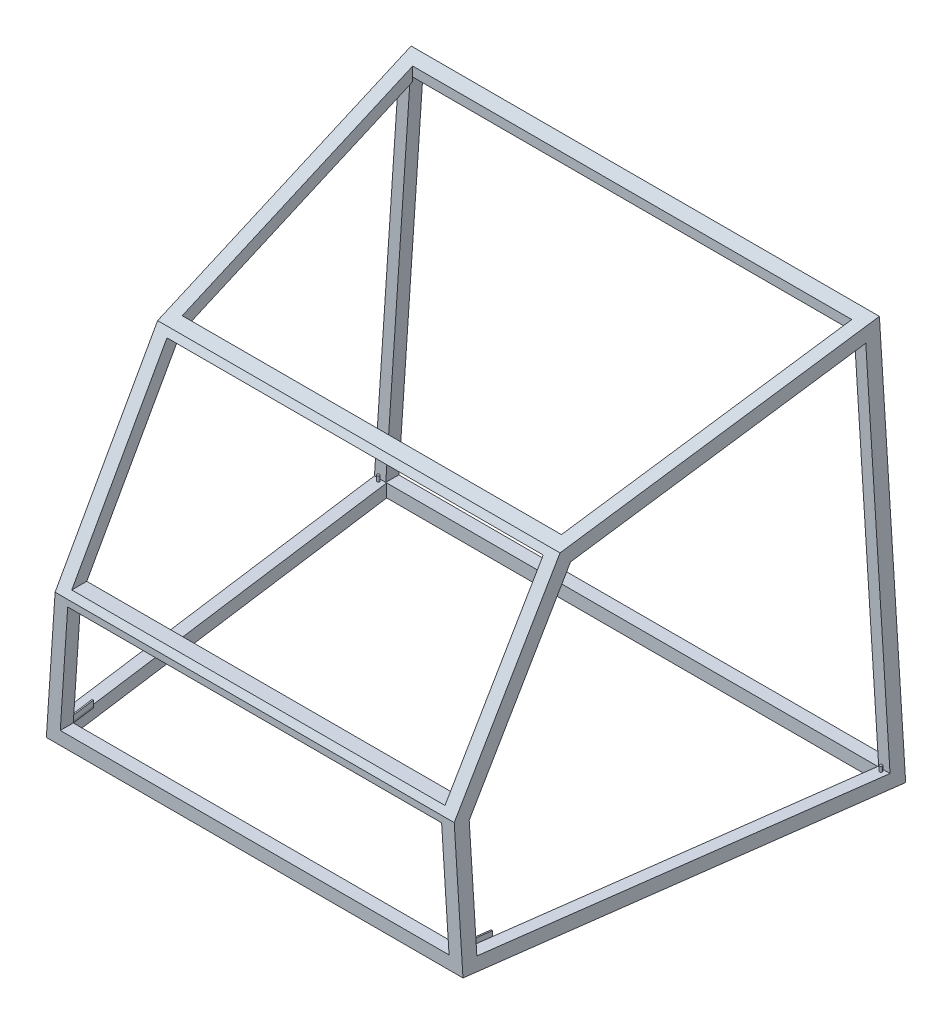
from build123d import *

# Parameters (mm, degrees)
BOSS_EXTRU_1_DEPTH           = 2000
ENL_V_MAT_EXTRU_1_DEPTH      = 2000
ENL_V_MAT_EXTRU_2_DEPTH      = 2000
ENL_V_MAT_EXTRU_3_DEPTH      = 2000
ENL_V_MAT_EXTRU_4_DEPTH      = 2933
ENL_V_MAT_EXTRU_5_DEPTH      = 2933
ENL_V_MAT_EXTRU_5_DEPTH_BACK = 2933
ENL_V_MAT_EXTRU_6_DEPTH      = 50
ENL_V_MAT_EXTRU_7_DEPTH      = 1023
ENL_V_MAT_EXTRU_8_DEPTH      = 50
ESQUISSE14_W                 = 94.610765079
ESQUISSE14_H                 = 3.897152032
BOSS_EXTRU_2_DEPTH           = 5
BOSS_EXTRU_28_START          = -6
BOSS_EXTRU_28_DEPTH          = 26
ESQUISSE12_R                 = 5
BOSS_EXTRU_29_DEPTH          = 20


with BuildPart() as part:
    # Esquisse1 → Boss.-Extru.1 (new body)
    with BuildSketch(Plane(origin=(0, 0, 0), x_dir=(0, 0, -1), z_dir=(1, 0, 0))):
        Polygon((-880.445159684, -98.858699346), (-480.445159684, 601.141300654), (619.554840316, 901.141300654), (619.554840316, -598.858699346), (-880.445159684, -598.858699346), align=None)
    extrude(amount=BOSS_EXTRU_1_DEPTH)

    # Esquisse2 → Enlèv. mat.-Extru.1 (cut)
    with BuildSketch(Plane.XZ.offset(598.858699346)):
        Polygon((2000, -619.554840316), (1800, 880.445159684), (2000, 880.445159684), align=None)
        Polygon((200, 880.445159684), (0, 880.445159684), (0, -619.554840316), align=None)
    extrude(amount=-ENL_V_MAT_EXTRU_1_DEPTH, mode=Mode.SUBTRACT)

    # Esquisse4 → Enlèv. mat.-Extru.2 (cut)
    with BuildSketch(Plane(origin=(116.098887378, 0, -870.741655333), x_dir=(0, 1, 0), z_dir=(0.13216372009101793, 0, -0.9912279006826347))):
        Polygon((-598.858699346, 1900.573128869), (901.141300654, 1900.573128869), (901.141300654, 1800.573128869), align=None)
    extrude(amount=-ENL_V_MAT_EXTRU_2_DEPTH, mode=Mode.SUBTRACT)

    # Esquisse5 → Enlèv. mat.-Extru.3 (cut)
    with BuildSketch(Plane(origin=(-81.164389561, 0, -608.732921708), x_dir=(0, 1, 0), z_dir=(0.13216372009101793, 0, 0.9912279006826347))):
        Polygon((901.141300654, -81.882672497), (-598.858699346, -81.882672497), (901.141300654, -181.882672497), align=None)
    extrude(amount=ENL_V_MAT_EXTRU_3_DEPTH, mode=Mode.SUBTRACT)

    # Esquisse6 → Enlèv. mat.-Extru.4 (cut)
    with BuildSketch(Plane(origin=(0, 0, 0), x_dir=(0, 0, -1), z_dir=(1, 0, 0))):
        Polygon((569.554840316, 835.678781331), (-447.308376432, 558.35244949), (-830.445159684, -112.1369212), (-830.445159684, -548.858699346), (569.554840316, -548.858699346), align=None)
    extrude(amount=ENL_V_MAT_EXTRU_4_DEPTH, mode=Mode.SUBTRACT)

    # Esquisse7 → Enlèv. mat.-Extru.5 (cut, two sides: drawn at the far end of the back side and taken through both)
    with BuildSketch(Plane.XY.offset(-ENL_V_MAT_EXTRU_5_DEPTH_BACK)):
        Polygon((282.05986694, -123.858699346), (253.475791256, -548.858699346), (1746.524208744, -548.858699346), (1717.94013306, -123.858699346), align=None)
        Polygon((283.406973938, -73.858699346), (1716.593026062, -73.858699346), (1722.400013951, 576.141300654), (277.599986049, 576.141300654), align=None)
        Polygon((176.229227458, 851.141300654), (271.096481507, 626.141300654), (1728.903518493, 626.141300654), (1823.770772542, 851.141300654), align=None)
    extrude(amount=ENL_V_MAT_EXTRU_5_DEPTH + ENL_V_MAT_EXTRU_5_DEPTH_BACK, mode=Mode.SUBTRACT)

    # Esquisse8 → Enlèv. mat.-Extru.6 (cut)
    with BuildSketch(Plane(origin=(0, 0, -619.554840316), x_dir=(-1, 0, 0), z_dir=(0, 0, -1))):
        Polygon((-1852.364900608, 851.141300654), (-1946.524208744, -548.858699346), (-53.475791256, -548.858699346), (-147.635099392, 851.141300654), align=None)
    extrude(amount=-ENL_V_MAT_EXTRU_6_DEPTH, mode=Mode.SUBTRACT)

    # Esquisse9 → Enlèv. mat.-Extru.7 (cut)
    with BuildSketch(Plane(origin=(0, 0, 0), x_dir=(1, 0, 0), z_dir=(0, 1, 0))):
        Polygon((156.96398896, 569.554840316), (271.954599929, -430.445159684), (1728.045400071, -430.445159684), (1843.03601104, 569.554840316), align=None)
    extrude(amount=ENL_V_MAT_EXTRU_7_DEPTH, mode=Mode.SUBTRACT)

    # Esquisse10 → Enlèv. mat.-Extru.8 (cut)
    with BuildSketch(Plane.XZ.offset(598.858699346)):
        Polygon((243.775819835, 830.445159684), (57.109153168, -569.554840316), (1942.890846832, -569.554840316), (1756.224180165, 830.445159684), align=None)
    extrude(amount=-ENL_V_MAT_EXTRU_8_DEPTH, mode=Mode.SUBTRACT)

    # Esquisse14 → Boss.-Extru.2 (add)
    with BuildSketch(Plane(origin=(1834.339717588, 0, 244.578629012), x_dir=(-0.13216372009101796, 0, 0.9912279006826348), z_dir=(-0.9912279006826348, 0, -0.13216372009101796))):
        with Locations((543.745908762, -550.807275362)):
            Rectangle(ESQUISSE14_W, ESQUISSE14_H)
    boss_extru_2 = extrude(amount=BOSS_EXTRU_2_DEPTH)

    # Esquisse15 → Boss.-Extru.28 (add)
    with BuildSketch(Plane(origin=(0, -548.858699346, 0), x_dir=(1, 0, 0), z_dir=(0, 1, 0)).offset(BOSS_EXTRU_28_START)):
        Polygon((1768.728290839, -736.664329633), (1763.772151335, -736.003511032), (1751.203848273, -830.563782674), (1756.224180165, -831.231050773), align=None)
    boss_extru_28 = extrude(amount=BOSS_EXTRU_28_DEPTH)

    # Esquisse12 → Boss.-Extru.29 (add)
    with BuildSketch(Plane(origin=(0, -548.858699346, 0), x_dir=(1, 0, 0), z_dir=(0, 1, 0))):
        with Locations(Location((1965.090614868, 559.554840316, 0), (0, 0, 270))):
            Circle(ESQUISSE12_R)
    boss_extru_29 = extrude(amount=BOSS_EXTRU_29_DEPTH)

    # Symétrie1: Boss.-Extru.2, Boss.-Extru.28, Boss.-Extru.29 across plane
    add(boss_extru_2.mirror(Plane(origin=(1000, 0, 0), x_dir=(0, 0, 1), z_dir=(1, 0, 0))))
    add(boss_extru_28.mirror(Plane(origin=(1000, 0, 0), x_dir=(0, 0, 1), z_dir=(1, 0, 0))))
    add(boss_extru_29.mirror(Plane(origin=(1000, 0, 0), x_dir=(0, 0, 1), z_dir=(1, 0, 0))))


solid = part.part
